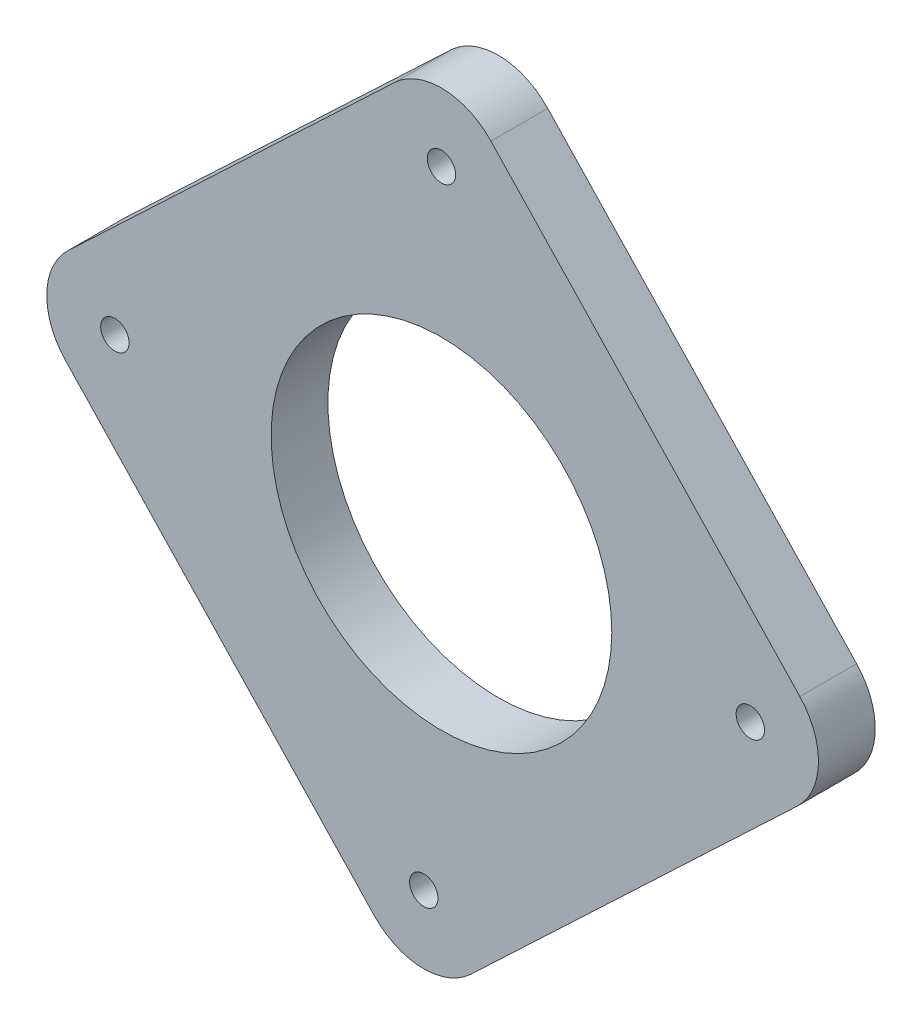
from build123d import *

# Parameters (mm, degrees)
SKETCH1_R           = 15
SKETCH1_R_2         = 1.25
BOSS_EXTRUDE1_DEPTH = 5


with BuildPart() as part:
    # Sketch1 → Boss-Extrude1 (new body)
    with BuildSketch(Plane.XY):
        with BuildLine():
            Line((-33.115304549, -3.323429394), (-5.914945157, -32.079801303))
            ThreePointArc((-5.914945157, -32.079801303), (-1.722792588, -33.954412887), (2.567057485, -32.315663941))
            Line((2.567057485, -32.315663941), (31.323429394, -5.115304549))
            ThreePointArc((31.323429394, -5.115304549), (33.198040978, -0.92315198), (31.559292032, 3.366698093))
            Line((31.559292032, 3.366698093), (4.35893264, 32.123070002))
            ThreePointArc((4.35893264, 32.123070002), (0.166780071, 33.997681586), (-4.123070002, 32.35893264))
            Line((-4.123070002, 32.35893264), (-32.879441911, 5.158573248))
            ThreePointArc((-32.879441911, 5.158573248), (-34.754053495, 0.966420679), (-33.115304549, -3.323429394))
        make_face()
        Circle(SKETCH1_R, mode=Mode.SUBTRACT)
        with Locations((0, 28)):
            Circle(SKETCH1_R_2, mode=Mode.SUBTRACT)
        with Locations((27.200359392, -0.756371909)):
            Circle(SKETCH1_R_2, mode=Mode.SUBTRACT)
        with Locations((-1.556012517, -27.956731301)):
            Circle(SKETCH1_R_2, mode=Mode.SUBTRACT)
        with Locations((-28.756371909, 0.799640608)):
            Circle(SKETCH1_R_2, mode=Mode.SUBTRACT)
    extrude(amount=BOSS_EXTRUDE1_DEPTH)


solid = part.part
